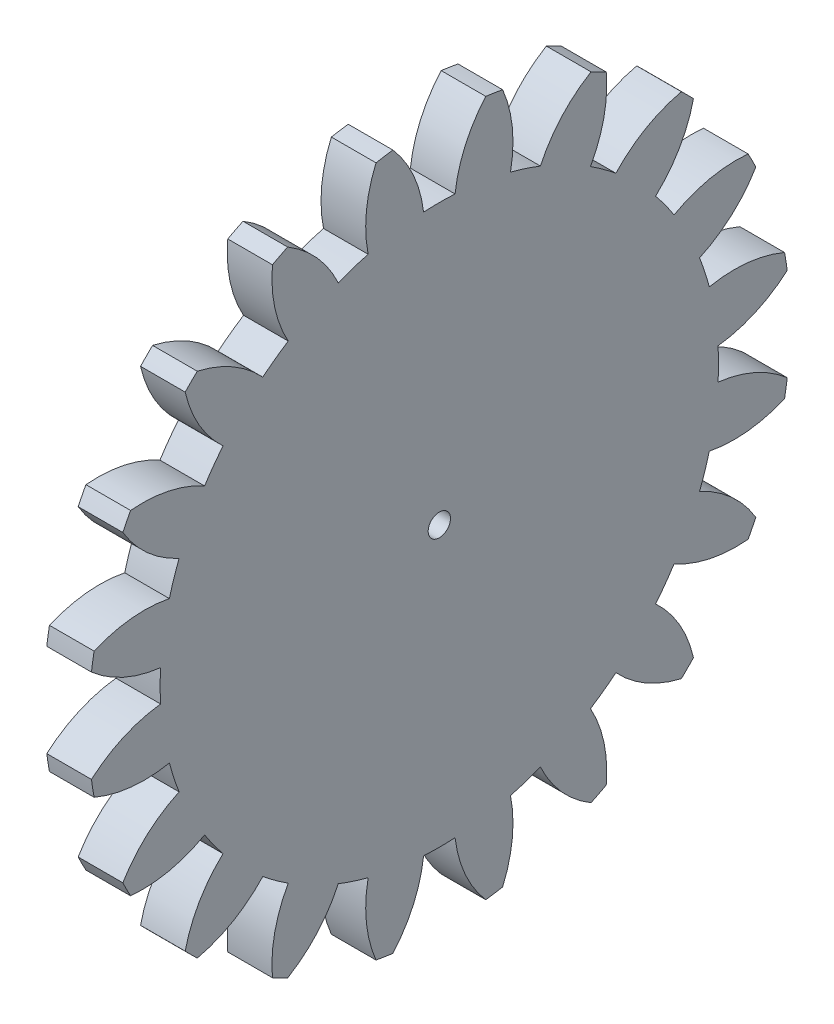
from build123d import *

# Parameters (mm, degrees)
BASPROSKE_W         = 30
BASPROSKE_H         = 55
TOOTHCUT_DEPTH      = 84.366660003
TEETHCUTS_COUNT     = 20
TEETHCUTS_ANGLE     = 342
HUBNEABOTSKE_R      = 12.5
HUBNEARBOTH_DEPTH   = 5.0000254
HUBFAR_START        = 5.0000254
HUBFARSKE_R         = 12.5
HUBFAR_DEPTH        = 5.0000254
BORSKE_R            = 5
BORE_DEPTH          = 40.0000508
SKETCH1_R           = 7
SKETCH1_R_2         = 1.75
BOSS_EXTRUDE1_DEPTH = 40.0000508
SKETCH2_R           = 61.585306659
CUT_EXTRUDE1_DEPTH  = 28
SKETCH3_R           = 13.575984162
CUT_EXTRUDE4_DEPTH  = 5.0000254


with BuildPart() as part:
    # BasProSke → Base-Revolve (revolve)
    with BuildSketch(Plane(origin=(0, 0, 0), x_dir=(1, 0, 0), z_dir=(0, 1, 0)), mode=Mode.PRIVATE) as base_revolve_sk:
        with Locations((15, 27.5)):
            Rectangle(BASPROSKE_W, BASPROSKE_H)
    revolve(base_revolve_sk.sketch.rotate(Axis((-10, 0, 0), (1, 0, 0)), 180), axis=Axis((-10, 0, 0), (1, 0, 0)))

    # TooCutSke → ToothCut (cut, through all)
    with BuildSketch(Plane(origin=(0, 0, 0), x_dir=(0, 0, -1), z_dir=(1, 0, 0))):
        with BuildLine():
            ThreePointArc((2.464838288, 43.679509764), (0, 43.749), (-2.464838288, 43.679509764))
            ThreePointArc((-2.464838288, 43.679509764), (-4.057398861, 49.476814676), (-7.300899231, 54.538899105))
            ThreePointArc((-7.300899231, 54.538899105), (0, 55.0254), (7.300899231, 54.538899105))
            ThreePointArc((7.300899231, 54.538899105), (4.057398861, 49.476814676), (2.464838288, 43.679509764))
        make_face()
    toothcut = extrude(amount=TOOTHCUT_DEPTH, mode=Mode.SUBTRACT)

    # TeethCuts: ToothCut ×20 about axis
    teethcuts_axis = Axis((-10, 0, 0), (1, 0, 0))
    for i in range(1, TEETHCUTS_COUNT):
        add(toothcut.rotate(teethcuts_axis, i * TEETHCUTS_ANGLE / (TEETHCUTS_COUNT - 1)), mode=Mode.SUBTRACT)

    # HubNeaBotSke → HubNearBoth (add)
    with BuildSketch(Plane.ZY):
        with Locations(Location((0, 0, 0), (0, 0, 180))):
            Circle(HUBNEABOTSKE_R)
    extrude(amount=HUBNEARBOTH_DEPTH)

    # HubFarSke → HubFar (add)
    with BuildSketch(Plane(origin=(30, 0, 0), x_dir=(0, 0, -1), z_dir=(1, 0, 0)).offset(HUBFAR_START)):
        Circle(HUBFARSKE_R)
    extrude(amount=-HUBFAR_DEPTH)

    # BorSke → Bore (cut, symmetric)
    with BuildSketch(Plane(origin=(0, 0, 0), x_dir=(0, 0, -1), z_dir=(1, 0, 0))):
        with Locations(Location((0, 0, 0), (0, 0, 180))):
            Circle(BORSKE_R)
    extrude(amount=BORE_DEPTH, both=True, mode=Mode.SUBTRACT)

    # Sketch1 → Boss-Extrude1 (add)
    with BuildSketch(Plane.ZY.offset(5.0000254)):
        Circle(SKETCH1_R)
        Circle(SKETCH1_R_2, mode=Mode.SUBTRACT)
    extrude(amount=-BOSS_EXTRUDE1_DEPTH)

    # Sketch2 → Cut-Extrude1 (cut)
    with BuildSketch(Plane(origin=(35.0000254, 0, 0), x_dir=(0, 0, -1), z_dir=(1, 0, 0))):
        Circle(SKETCH2_R)
    extrude(amount=-CUT_EXTRUDE1_DEPTH, mode=Mode.SUBTRACT)

    # Sketch3 → Cut-Extrude4 (cut)
    with BuildSketch(Plane.ZY.offset(5.0000254)):
        Circle(SKETCH3_R)
    extrude(amount=-CUT_EXTRUDE4_DEPTH, mode=Mode.SUBTRACT)


solid = part.part
